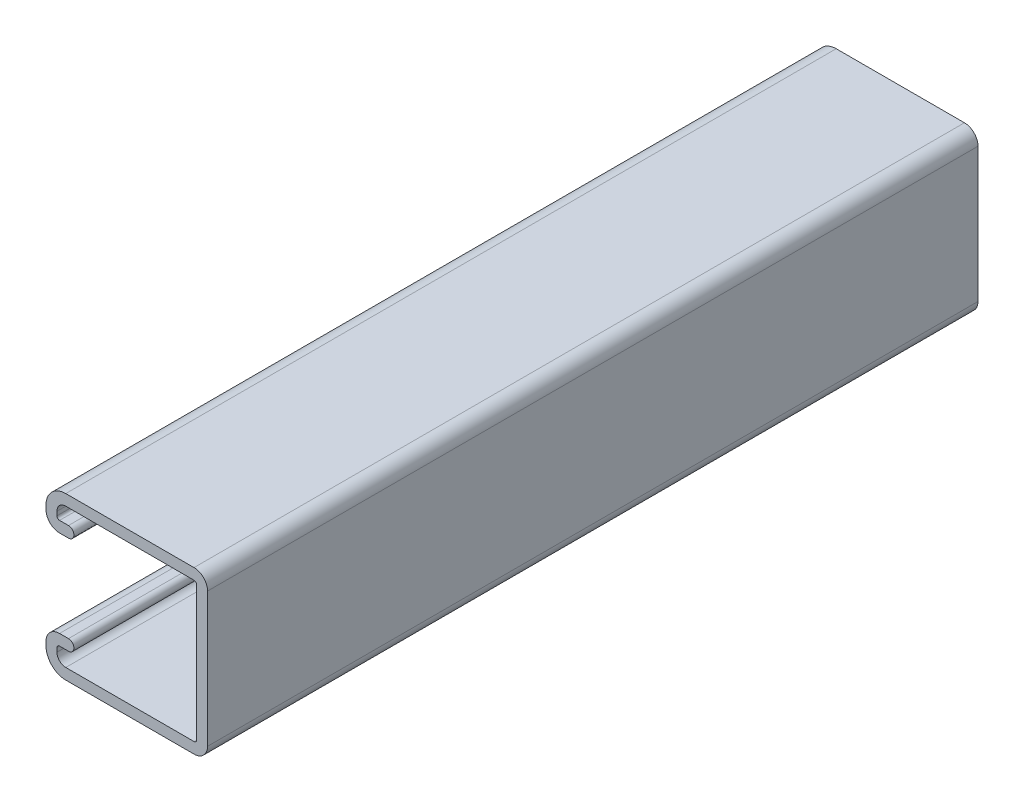
from build123d import *

# Parameters (mm, degrees)
BOSS_EXTRUDE1_DEPTH = 98.425


with BuildPart() as part:
    # Sketch1 → Boss-Extrude1 (new, symmetric)
    with BuildSketch(Plane.XY):
        with BuildLine():
            Line((-36.22675, 20.6375), (-3.46075, 20.6375))
            ThreePointArc((-3.46075, 20.6375), (-1.013630207, 19.623869793), (0, 17.17675))
            Line((0, 17.17675), (0, -17.17675))
            ThreePointArc((0, -17.17675), (-1.013630207, -19.623869793), (-3.46075, -20.6375))
            Line((-3.46075, -20.6375), (-36.22675, -20.6375))
            ThreePointArc((-36.22675, -20.6375), (-39.796401808, -19.158901808), (-41.275, -15.58925))
            Line((-41.275, -15.58925), (-41.275, -14.57325))
            ThreePointArc((-41.275, -14.57325), (-40.261369793, -12.126130207), (-37.81425, -11.1125))
            Line((-37.81425, -11.1125), (-35.5346, -11.1125))
            ThreePointArc((-35.5346, -11.1125), (-34.1376, -12.5095), (-35.5346, -13.9065))
            Line((-35.5346, -13.9065), (-37.81425, -13.9065))
            ThreePointArc((-37.81425, -13.9065), (-38.285713446, -14.101786554), (-38.481, -14.57325))
            Line((-38.481, -14.57325), (-38.481, -15.58925))
            ThreePointArc((-38.481, -15.58925), (-37.820745461, -17.183245461), (-36.22675, -17.8435))
            Line((-36.22675, -17.8435), (-3.46075, -17.8435))
            ThreePointArc((-3.46075, -17.8435), (-2.989286554, -17.648213446), (-2.794, -17.17675))
            Line((-2.794, -17.17675), (-2.794, 17.17675))
            ThreePointArc((-2.794, 17.17675), (-2.989286554, 17.648213446), (-3.46075, 17.8435))
            Line((-3.46075, 17.8435), (-36.22675, 17.8435))
            ThreePointArc((-36.22675, 17.8435), (-37.820745461, 17.183245461), (-38.481, 15.58925))
            Line((-38.481, 15.58925), (-38.481, 14.57325))
            ThreePointArc((-38.481, 14.57325), (-38.285713446, 14.101786554), (-37.81425, 13.9065))
            Line((-37.81425, 13.9065), (-35.5346, 13.9065))
            ThreePointArc((-35.5346, 13.9065), (-34.1376, 12.5095), (-35.5346, 11.1125))
            Line((-35.5346, 11.1125), (-37.81425, 11.1125))
            ThreePointArc((-37.81425, 11.1125), (-40.261369793, 12.126130207), (-41.275, 14.57325))
            Line((-41.275, 14.57325), (-41.275, 15.58925))
            ThreePointArc((-41.275, 15.58925), (-39.796401808, 19.158901808), (-36.22675, 20.6375))
        make_face()
    extrude(amount=BOSS_EXTRUDE1_DEPTH, both=True)


solid = part.part
